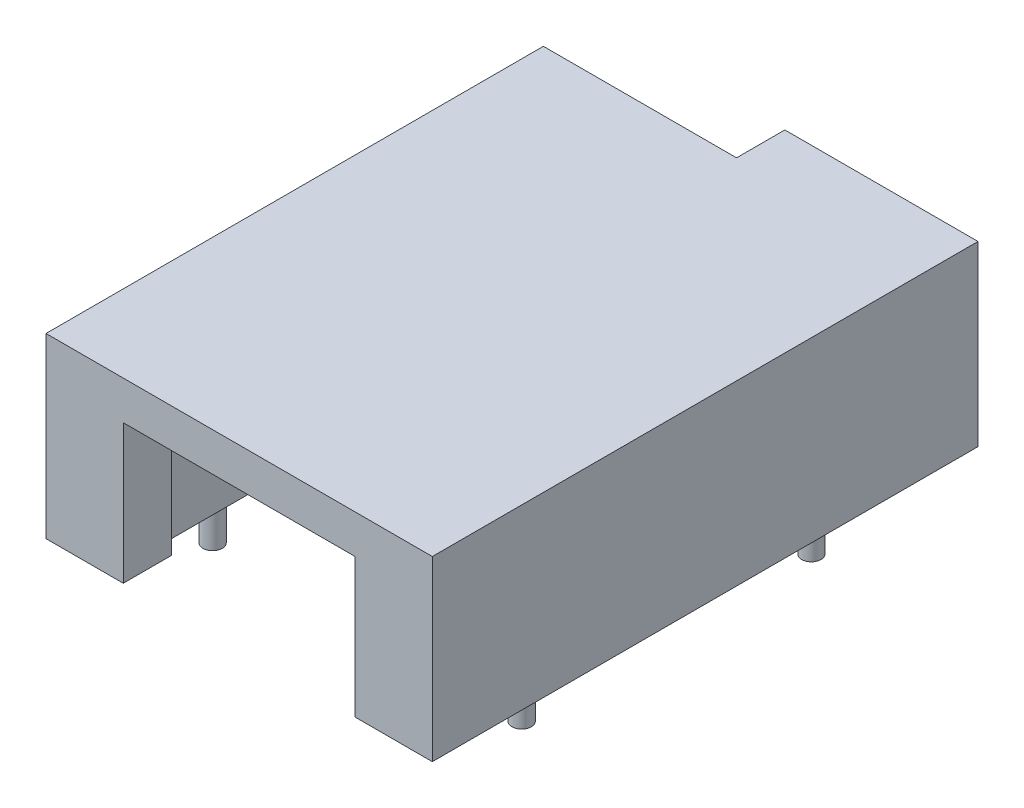
from build123d import *

# Parameters (mm, degrees)
SKETCH_1_W               = 40
SKETCH_1_H               = 18.4
EXTRUDE_1_DEPTH          = 46.5
CUT_EXTRUDE_1_DEPTH      = 65.037567099
CUT_EXTRUDE_1_DEPTH_BACK = 65.037567099
SKETCH_2_W               = 27
SKETCH_2_H               = 14.4
SKETCH_3_W               = 1.5
SKETCH_3_H               = 14.4
EXTRUDE_2_DEPTH          = 5
SKETCH_4_W               = 13.5
SKETCH_4_H               = 14.4
EXTRUDE_3_DEPTH          = 5
SKETCH_6_R               = 1
EXTRUDE_4_DEPTH          = 5


with BuildPart() as part:
    # 스케치1 → 보스-돌출1 (new body)
    with BuildSketch(Plane.XY):
        with Locations((20, 9.2)):
            Rectangle(SKETCH_1_W, SKETCH_1_H)
    extrude(amount=EXTRUDE_1_DEPTH)

    # 스케치2 → 컷-돌출1 (cut, two sides: drawn at the far end of the back side and taken through both)
    with BuildSketch(Plane.XY.offset(46.5).offset(-CUT_EXTRUDE_1_DEPTH_BACK)):
        with Locations((20, 7.2)):
            Rectangle(SKETCH_2_W, SKETCH_2_H)
    extrude(amount=CUT_EXTRUDE_1_DEPTH + CUT_EXTRUDE_1_DEPTH_BACK, mode=Mode.SUBTRACT)

    # 스케치3 → 보스-돌출2 (add)
    with BuildSketch(Plane.XY.offset(46.5)):
        Polygon((0, 18.4), (0, 0), (6.5, 0), (6.5, 14.4), (33.5, 14.4), (33.5, 0), (40, 0), (40, 18.4), align=None)
        with Locations((7.25, 7.2)):
            Rectangle(SKETCH_3_W, SKETCH_3_H)
        with Locations((32.75, 7.2)):
            Rectangle(SKETCH_3_W, SKETCH_3_H)
    extrude(amount=EXTRUDE_2_DEPTH)

    # 스케치4 → 보스-돌출3 (add)
    with BuildSketch(Plane(origin=(0, 0, 0), x_dir=(-1, 0, 0), z_dir=(0, 0, -1))):
        Polygon((-20, 14.4), (-20, 18.4), (-40, 18.4), (-40, 0), (-33.5, 0), (-33.5, 14.4), align=None)
        with Locations((-26.75, 7.2)):
            Rectangle(SKETCH_4_W, SKETCH_4_H)
    extrude(amount=EXTRUDE_3_DEPTH)

    # 스케치6 → 보스-돌출4 (add)
    with BuildSketch(Plane.XZ):
        with Locations(Location((36, 38.25, 0), (0, 0, 90))):
            Circle(SKETCH_6_R)
        with Locations(Location((4, 38.25, 0), (0, 0, 90))):
            Circle(SKETCH_6_R)
        with Locations(Location((4, 8.25, 0), (0, 0, 90))):
            Circle(SKETCH_6_R)
        with Locations(Location((36, 8.25, 0), (0, 0, 90))):
            Circle(SKETCH_6_R)
    extrude(amount=EXTRUDE_4_DEPTH)


solid = part.part
